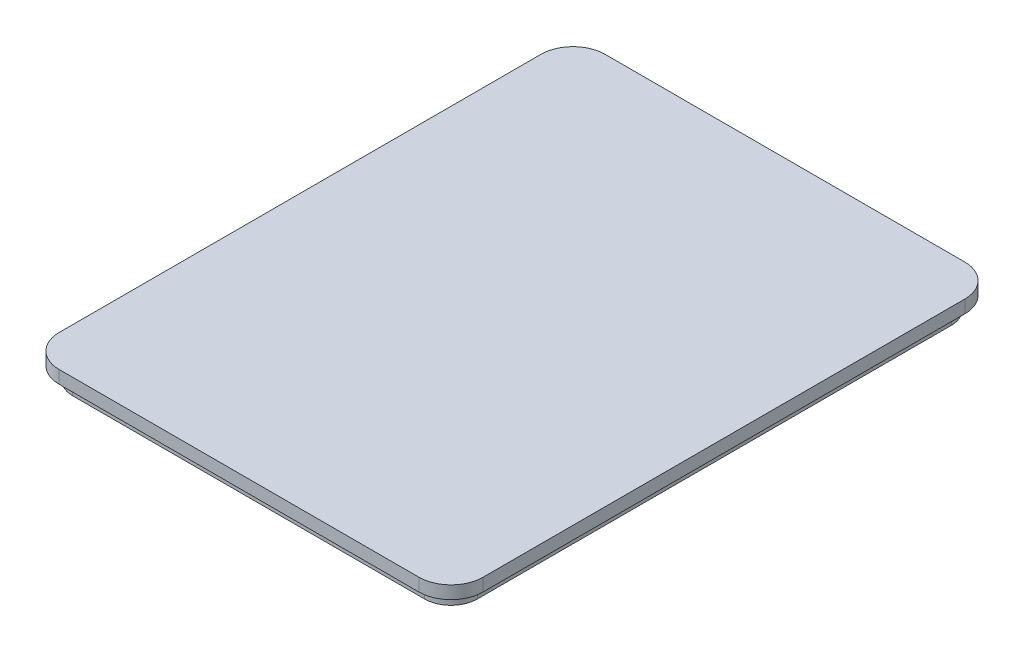
from build123d import *

# Parameters (mm, degrees)
ESTRUSIONE_ESTRUSIONE1_DEPTH = 2
ESTRUSIONE_ESTRUSIONE2_DEPTH = 2


with BuildPart() as part:
    # Schizzo1 → Estrusione-Estrusione1 (new body)
    with BuildSketch(Plane(origin=(0, 0, 0), x_dir=(1, 0, 0), z_dir=(0, 1, 0))):
        with BuildLine():
            Line((5, 0), (61, 0))
            ThreePointArc((61, 0), (64.535533906, 1.464466094), (66, 5))
            Line((66, 5), (66, 80))
            ThreePointArc((66, 80), (64.535533906, 83.535533906), (61, 85))
            Line((61, 85), (5, 85))
            ThreePointArc((5, 85), (1.464466094, 83.535533906), (0, 80))
            Line((0, 80), (0, 5))
            ThreePointArc((0, 5), (1.464466094, 1.464466094), (5, 0))
        make_face()
    extrude(amount=ESTRUSIONE_ESTRUSIONE1_DEPTH)

    # Schizzo2 → Estrusione-Estrusione2 (add)
    with BuildSketch(Plane.XZ):
        with BuildLine():
            Line((60.393923704, -83.5), (5.606076296, -83.5))
            ThreePointArc((5.606076296, -83.5), (2.702641903, -82.297358097), (1.5, -79.393923704))
            Line((1.5, -79.393923704), (1.5, -5.606076296))
            ThreePointArc((1.5, -5.606076296), (2.702641903, -2.702641903), (5.606076296, -1.5))
            Line((5.606076296, -1.5), (60.393923704, -1.5))
            ThreePointArc((60.393923704, -1.5), (63.297358097, -2.702641903), (64.5, -5.606076296))
            Line((64.5, -5.606076296), (64.5, -79.393923704))
            ThreePointArc((64.5, -79.393923704), (63.297358097, -82.297358097), (60.393923704, -83.5))
        make_face()
    extrude(amount=ESTRUSIONE_ESTRUSIONE2_DEPTH)


solid = part.part
